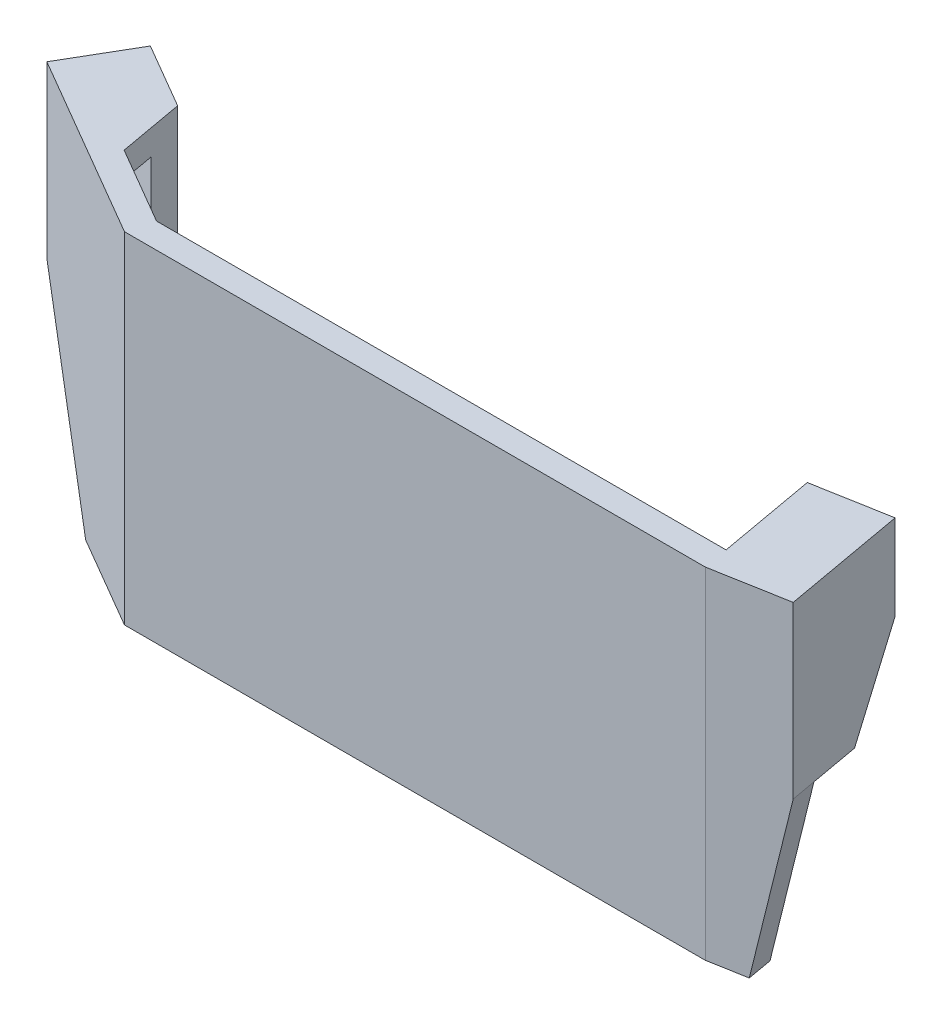
from build123d import *

# Parameters (mm, degrees)
BOSS_EXTRUDE1_DEPTH = 2
BOSS_EXTRUDE2_DEPTH = 25
BOSS_EXTRUDE3_DEPTH = 11.5
CUT_EXTRUDE2_DEPTH  = 2
CUT_EXTRUDE3_DEPTH  = 2.03188945
SKETCH8_W           = 7.96811055
SKETCH8_H           = 13.5
CUT_EXTRUDE4_DEPTH  = 2
CUT_EXTRUDE5_REACH  = 73.825
CUT_EXTRUDE6_DEPTH  = 2


with BuildPart() as part:
    # Sketch2 → Boss-Extrude1 (new body)
    with BuildSketch(Plane(origin=(0, 0, 0), x_dir=(1, 0, 0), z_dir=(0, 1, 0))):
        Polygon((-22.485232694, 2), (22.666829492, 2), (21.260674764, 9.843055182), (27.166507873, 10.901891943), (28.931235809, 1.058836761), (23.0254027, 0), (-23.0254027, 0), (-37.76942689, 8.590954614), (-34.748752683, 13.775115813), (-29.564591484, 10.754441606), (-28.637765281, 5.584918712), align=None)
    extrude(amount=-BOSS_EXTRUDE1_DEPTH)

    # Sketch3 → Boss-Extrude2 (add)
    with BuildSketch(Plane.XZ.offset(2)):
        Polygon((-37.76942689, -8.590954614), (-23.0254027, 0), (23.0254027, 0), (28.931235809, -1.058836761), (28.572662601, -3.058836759), (24.635440529, -2.352945585), (23.229285801, -10.196000769), (21.260674764, -9.843055182), (22.666829492, -2), (-22.485232694, -2), (-28.637765281, -5.584918712), (-36.762535488, -10.319008347), align=None)
    extrude(amount=BOSS_EXTRUDE2_DEPTH)

    # Sketch4 → Boss-Extrude3 (add)
    with BuildSketch(Plane.XZ.offset(2)):
        Polygon((25.197896837, -10.548946356), (26.604051565, -2.705891172), (28.572662601, -3.058836759), (27.166507873, -10.901891943), align=None)
        Polygon((-34.748752683, -13.775115813), (-35.755644085, -12.04706208), (-29.101178382, -8.169680159), (-29.564591484, -10.754441606), align=None)
    extrude(amount=BOSS_EXTRUDE3_DEPTH)

    # Sketch5 → Cut-Extrude2 (cut)
    with BuildSketch(Plane(origin=(-5.835962708, 0, 10.015834002), x_dir=(0.8640268665049071, 0, 0.5034457011016299), z_dir=(-0.5034457011016299, 0, 0.8640268665049071))):
        Polygon((-28.426722639, -27), (-36.958878734, -13.5), (-36.958878734, -27), align=None)
    extrude(amount=-CUT_EXTRUDE2_DEPTH, mode=Mode.SUBTRACT)

    # Sketch6 → Cut-Extrude3 (cut)
    with BuildSketch(Plane(origin=(0.717071985, 0, 3.999584852), x_dir=(0.9843055181910936, 0, -0.1764727935364628), z_dir=(0.1764727935364628, 0, 0.9843055181910936))):
        Polygon((25.664030936, -27), (28.664030936, -27), (28.664030936, -13.5), align=None)
    extrude(amount=-CUT_EXTRUDE3_DEPTH, mode=Mode.SUBTRACT)

    # Sketch8 → Cut-Extrude4 (cut)
    with BuildSketch(Plane(origin=(24.276941751, 0, -4.352530439), x_dir=(-0.17647279353646367, 0, -0.9843055181910934), z_dir=(0.9843055181910934, 0, -0.17647279353646367))):
        with Locations((1.952587588, -20.25)):
            Rectangle(SKETCH8_W, SKETCH8_H)
    extrude(amount=-CUT_EXTRUDE4_DEPTH, mode=Mode.SUBTRACT)

    # Cut-Extrude5: up to this face of the body (flat: up to its plane)
    cut_extrude5_end = Plane(part.part.faces().sort_by_distance((21.963752128, -6.75, -5.921527591))[0])
    # Sketch9 → Cut-Extrude5 (cut, up to the picked face)
    with BuildSketch(Plane(origin=(28.214163824, 0, -5.058421613), x_dir=(-0.17647279353646197, 0, -0.9843055181910936), z_dir=(0.9843055181910936, 0, -0.17647279353646197)), mode=Mode.PRIVATE) as cut_extrude5_sk1:
        Polygon((1.952587588, -13.5), (5.936642863, -6.75), (5.936642863, -13.5), align=None)
    cut_extrude5_tool1 = split(extrude(cut_extrude5_sk1.sketch, amount=-CUT_EXTRUDE5_REACH, mode=Mode.PRIVATE), bisect_by=cut_extrude5_end, keep=Keep.BOTH, mode=Mode.PRIVATE)
    add(cut_extrude5_tool1.solids().sort_by(Axis((27.400867, -11.25, -9.594716), (-0.9843055181910936, 0, 0.17647279353646197)))[0], mode=Mode.SUBTRACT)

    # Sketch10 → Cut-Extrude6 (cut)
    with BuildSketch(Plane(origin=(-2.815288501, 0, 4.831672803), x_dir=(-0.8640268665049072, 0, -0.5034457011016296), z_dir=(0.5034457011016296, 0, -0.8640268665049072))):
        Polygon((36.958878734, -6.75), (33.958878734, -13.5), (36.958878734, -13.5), align=None)
    extrude(amount=-CUT_EXTRUDE6_DEPTH, mode=Mode.SUBTRACT)


solid = part.part
